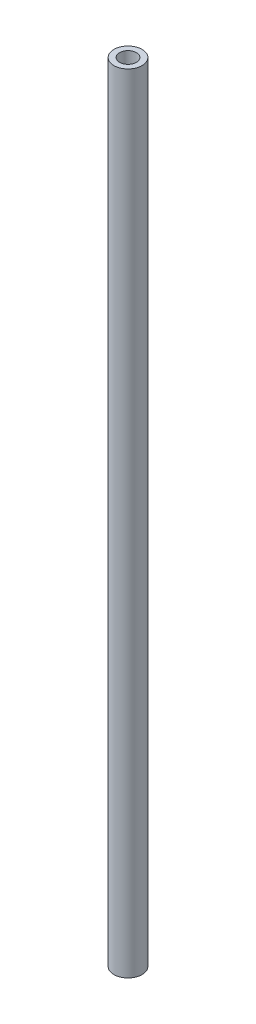
from build123d import *

# Parameters (mm, degrees)
SKETCH1_R           = 2.5
SKETCH1_R_2         = 1.5
BOSS_EXTRUDE1_DEPTH = 70


with BuildPart() as part:
    # Sketch1 → Boss-Extrude1 (new, symmetric)
    with BuildSketch(Plane(origin=(0, 0, 0), x_dir=(1, 0, 0), z_dir=(0, 1, 0))):
        with Locations(Location((0, 0, 0), (0, 0, 270))):
            Circle(SKETCH1_R)
        with Locations(Location((0, 0, 0), (0, 0, 270))):
            Circle(SKETCH1_R_2, mode=Mode.SUBTRACT)
    extrude(amount=BOSS_EXTRUDE1_DEPTH, both=True)


solid = part.part
